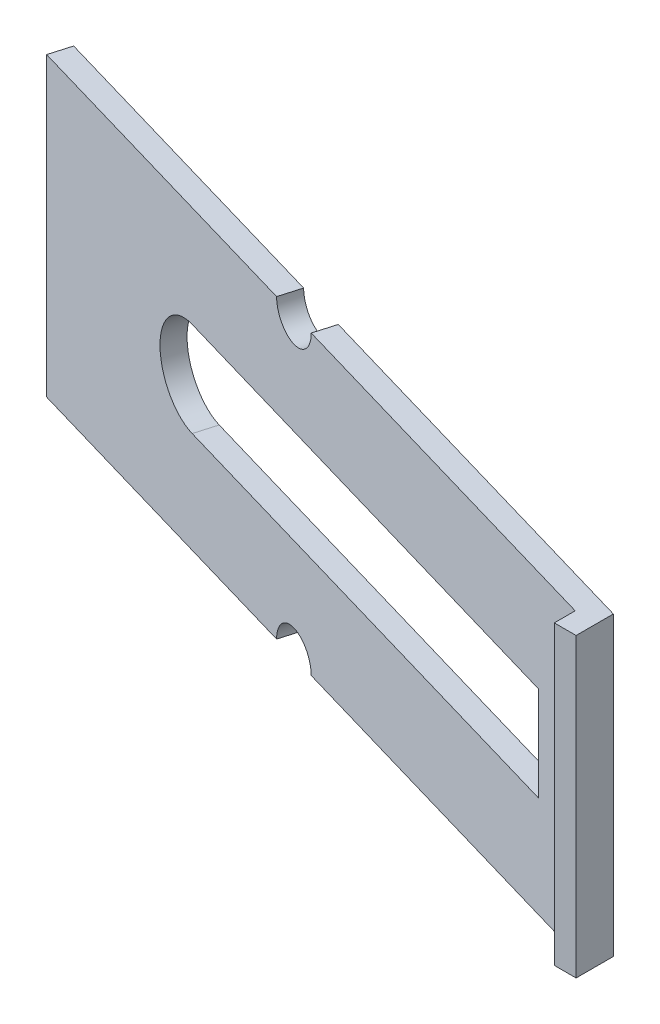
from build123d import *

# Parameters (mm, degrees)
BOSS_EXTRUDE1_DEPTH = 4.08
CUT_EXTRUDE1_DEPTH  = 0.3
CUT_EXTRUDE2_DEPTH  = 0.3


with BuildPart() as part:
    # Sketch1 → Boss-Extrude1 (new body)
    with BuildSketch(Plane(origin=(0, 0, 0), x_dir=(1, 0, 0), z_dir=(0, 1, 0))):
        Polygon((-0.15, 0), (-0.15, 0.287479127), (-10.410512779, 3.278145873), (-10.326564075, 3.56616083), (0.15, 0.512520873), (0.15, 0), align=None)
    extrude(amount=BOSS_EXTRUDE1_DEPTH)

    # Sketch2 → Cut-Extrude1 (cut)
    with BuildSketch(Plane(origin=(0.149434274, 0, -0.512685767), x_dir=(-0.9600498543859305, 0, -0.2798290140309858), z_dir=(0.2798290140309858, 0, -0.9600498543859306))):
        with BuildLine():
            Line((0.969410732, 1.39), (7.969410732, 1.39))
            ThreePointArc((7.969410732, 1.39), (8.619410732, 2.04), (7.969410732, 2.69))
            Line((7.969410732, 2.69), (0.969410732, 2.69))
            Line((0.969410732, 2.69), (0.969410732, 1.39))
        make_face()
    extrude(amount=-CUT_EXTRUDE1_DEPTH, mode=Mode.SUBTRACT)

    # Sketch3 → Cut-Extrude2 (cut)
    with BuildSketch(Plane(origin=(0.149434274, 0, -0.512685767), x_dir=(-0.9600498543859305, 0, -0.2798290140309858), z_dir=(0.2798290140309858, 0, -0.9600498543859306))):
        with BuildLine():
            Line((5.561931606, 4.08), (6.261931606, 4.08))
            ThreePointArc((6.261931606, 4.08), (5.911931606, 3.73), (5.561931606, 4.08))
        make_face()
        with BuildLine():
            Line((5.561931606, 0), (6.261931606, 0))
            ThreePointArc((6.261931606, 0), (5.911931606, 0.35), (5.561931606, 0))
        make_face()
    extrude(amount=-CUT_EXTRUDE2_DEPTH, mode=Mode.SUBTRACT)


solid = part.part
